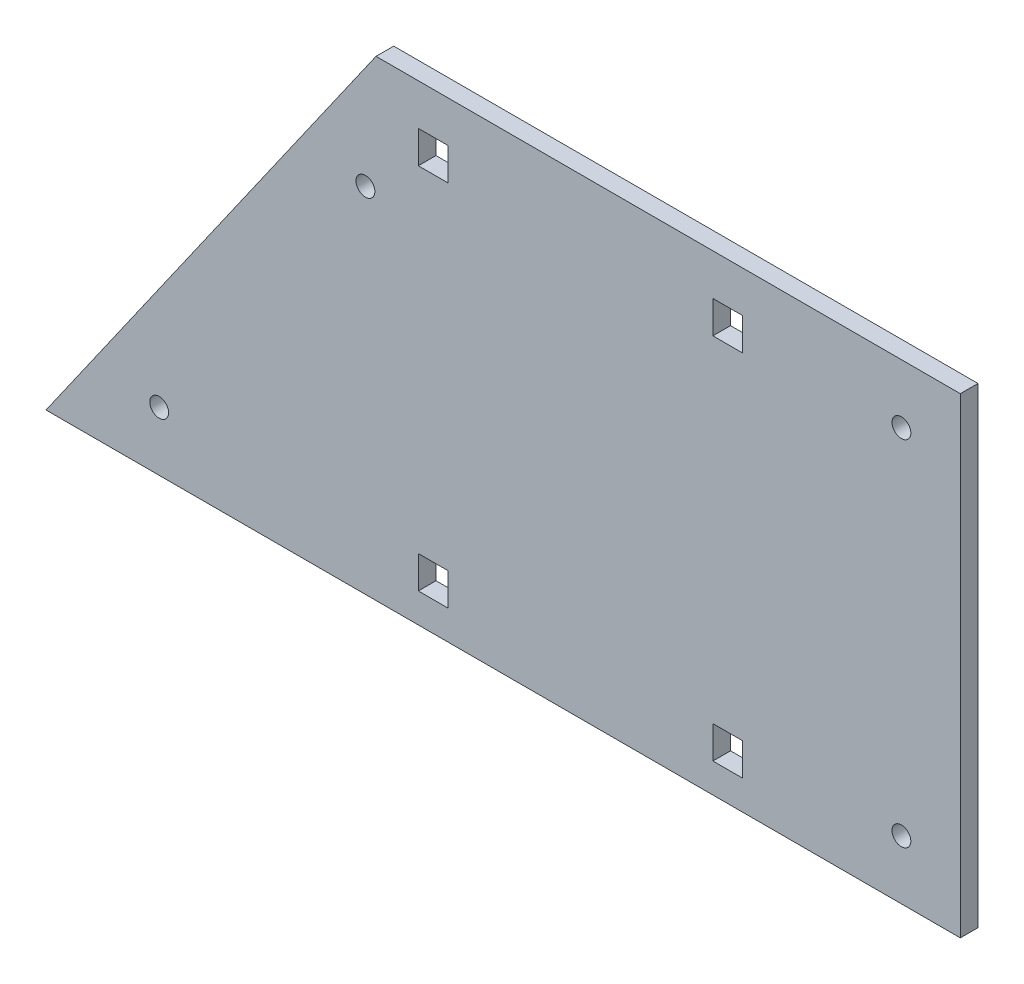
from build123d import *

# Parameters (mm, degrees)
SKETCH_1_R             = 1.6
EXTRUDE_2_DEPTH        = 3
SKETCH_2_W             = 5
SKETCH_2_H             = 5.5
CUT_EXTRUDE_1_DEPTH    = 5
PATTERN_LINEAR_1_COUNT = 2
PATTERN_LINEAR_1_PITCH = 62.5


with BuildPart() as part:
    # 草图1 → 凸台-拉伸2 (new body)
    with BuildSketch(Plane.XY):
        Polygon((137.75, -25.25), (38.57, -25.25), (-17.446603057, -105.25), (137.75, -105.25), align=None)
        with Locations((36.773595123, -45.25)):
            Circle(SKETCH_1_R, mode=Mode.SUBTRACT)
        with Locations((1.763218213, -95.25)):
            Circle(SKETCH_1_R, mode=Mode.SUBTRACT)
        with Locations((127.75, -35.25)):
            Circle(SKETCH_1_R, mode=Mode.SUBTRACT)
        with Locations((127.75, -95.25)):
            Circle(SKETCH_1_R, mode=Mode.SUBTRACT)
    extrude(amount=EXTRUDE_2_DEPTH)

    # 草图2 → 切除-拉伸1 (cut)
    with BuildSketch(Plane.XY.offset(3)):
        with Locations((98.25, -97.500011017)):
            Rectangle(SKETCH_2_W, SKETCH_2_H)
        with Locations((48.25, -97.500011017)):
            Rectangle(SKETCH_2_W, SKETCH_2_H)
    cut_extrude_1 = extrude(amount=-CUT_EXTRUDE_1_DEPTH, mode=Mode.SUBTRACT)

    # 阵列(线性)1: 切除-拉伸1 ×2
    with Locations(*[(0, i * PATTERN_LINEAR_1_PITCH, 0) for i in range(1, PATTERN_LINEAR_1_COUNT)]):
        add(cut_extrude_1, mode=Mode.SUBTRACT)


solid = part.part
